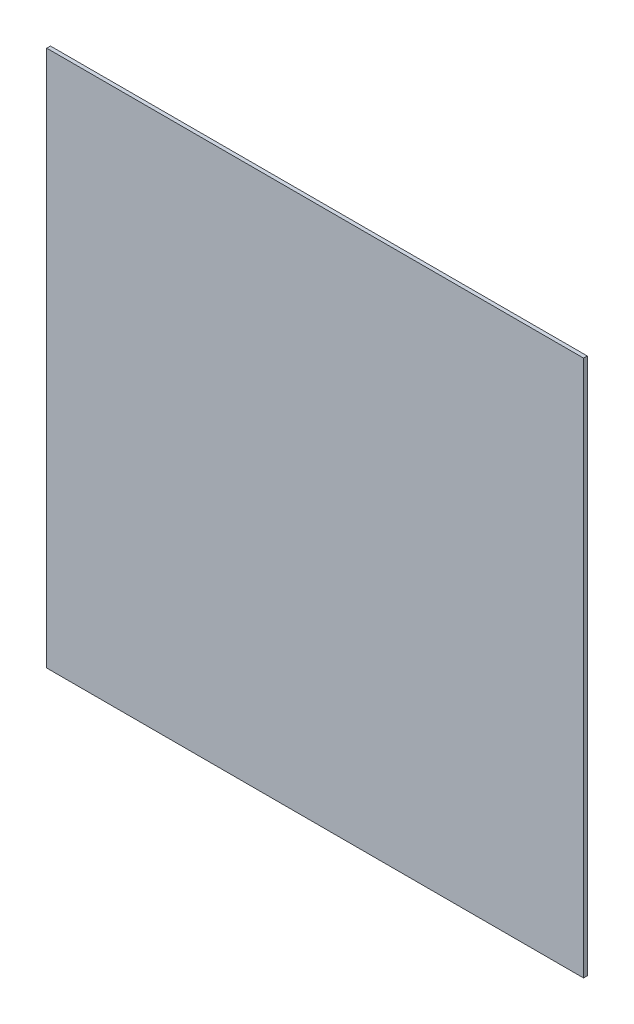
from build123d import *

# Parameters (mm, degrees)
SKETCH2_W           = 914.4
SKETCH2_H           = 914.4
BOSS_EXTRUDE1_DEPTH = 6.35


with BuildPart() as part:
    # Sketch2 → Boss-Extrude1 (new body)
    with BuildSketch(Plane.XY):
        Rectangle(SKETCH2_W, SKETCH2_H)
    extrude(amount=BOSS_EXTRUDE1_DEPTH)


solid = part.part
